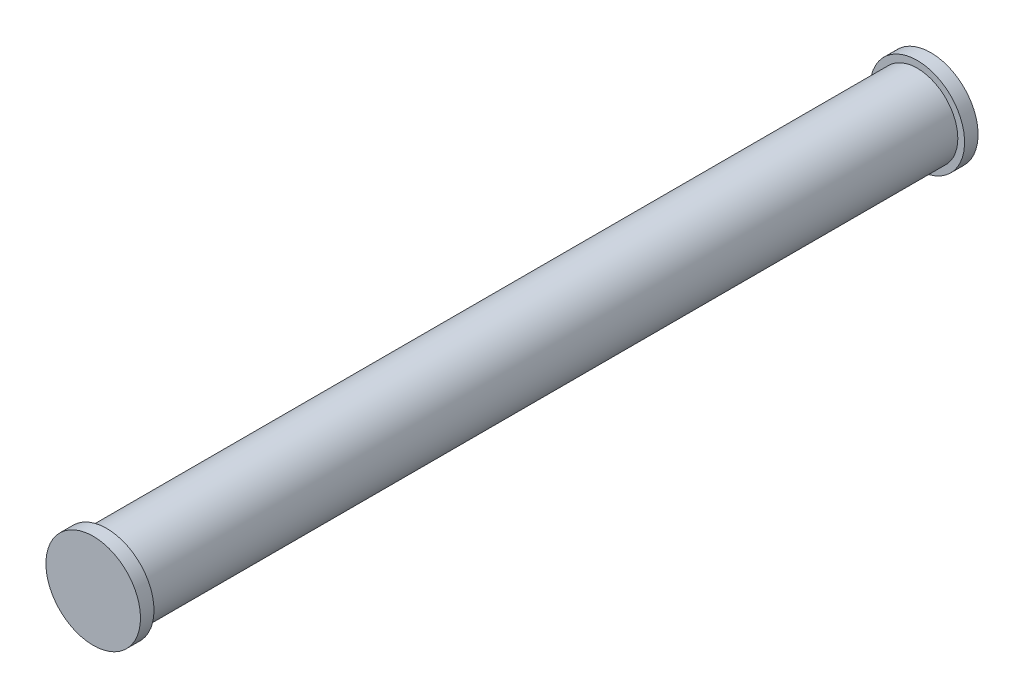
from build123d import *

# Parameters (mm, degrees)
BOSS_EXTRUDE1_DEPTH      = 30
BOSS_EXTRUDE1_DEPTH_BACK = 30
SKETCH1_R                = 3
SKETCH2_R                = 3.5
BOSS_EXTRUDE2_DEPTH      = 1
BOSS_EXTRUDE3_START      = 1
SKETCH3_R                = 3.5
BOSS_EXTRUDE3_DEPTH      = 1


with BuildPart() as part:
    # Sketch1 → Boss-Extrude1 (new, two sides: drawn at the far end of the back side and taken through both)
    with BuildSketch(Plane.XY.offset(-BOSS_EXTRUDE1_DEPTH_BACK)):
        Circle(SKETCH1_R)
    extrude(amount=BOSS_EXTRUDE1_DEPTH + BOSS_EXTRUDE1_DEPTH_BACK)

    # Sketch2 → Boss-Extrude2 (add)
    with BuildSketch(Plane.XY.offset(30)):
        Circle(SKETCH2_R)
    extrude(amount=BOSS_EXTRUDE2_DEPTH)

    # Sketch3 → Boss-Extrude3 (add)
    with BuildSketch(Plane(origin=(0, 0, -30), x_dir=(-1, 0, 0), z_dir=(0, 0, -1)).offset(BOSS_EXTRUDE3_START)):
        Circle(SKETCH3_R)
    extrude(amount=-BOSS_EXTRUDE3_DEPTH)


solid = part.part
